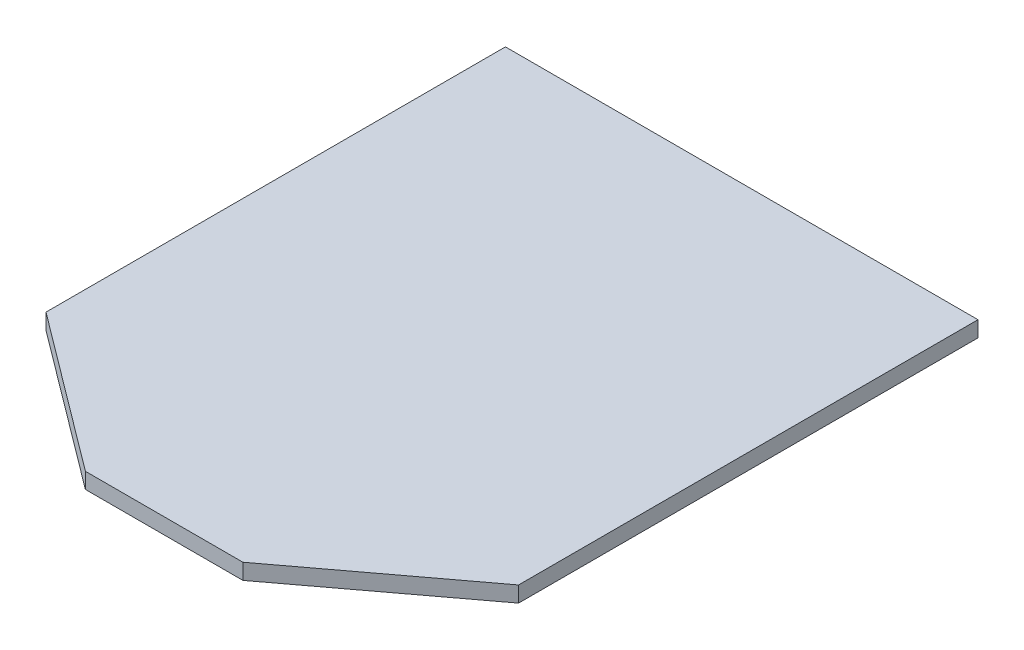
from build123d import *

# Parameters (mm, degrees)
SKETCH1_W           = 180
SKETCH1_H           = 220
BOSS_EXTRUDE1_DEPTH = 6
CUT_EXTRUDE1_DEPTH  = 143.253295217


with BuildPart() as part:
    # Sketch1 → Boss-Extrude1 (new body)
    with BuildSketch(Plane(origin=(0, 0, 0), x_dir=(1, 0, 0), z_dir=(0, 1, 0))):
        Rectangle(SKETCH1_W, SKETCH1_H)
    extrude(amount=BOSS_EXTRUDE1_DEPTH)

    # Sketch2 → Cut-Extrude1 (cut, through all)
    with BuildSketch(Plane(origin=(0, 6, 0), x_dir=(1, 0, 0), z_dir=(0, 1, 0))):
        Polygon((-90, -110), (-30, -110), (-90, -65), align=None)
        Polygon((30, -110), (90, -65), (90, -110), align=None)
    extrude(amount=-CUT_EXTRUDE1_DEPTH, mode=Mode.SUBTRACT)


solid = part.part
